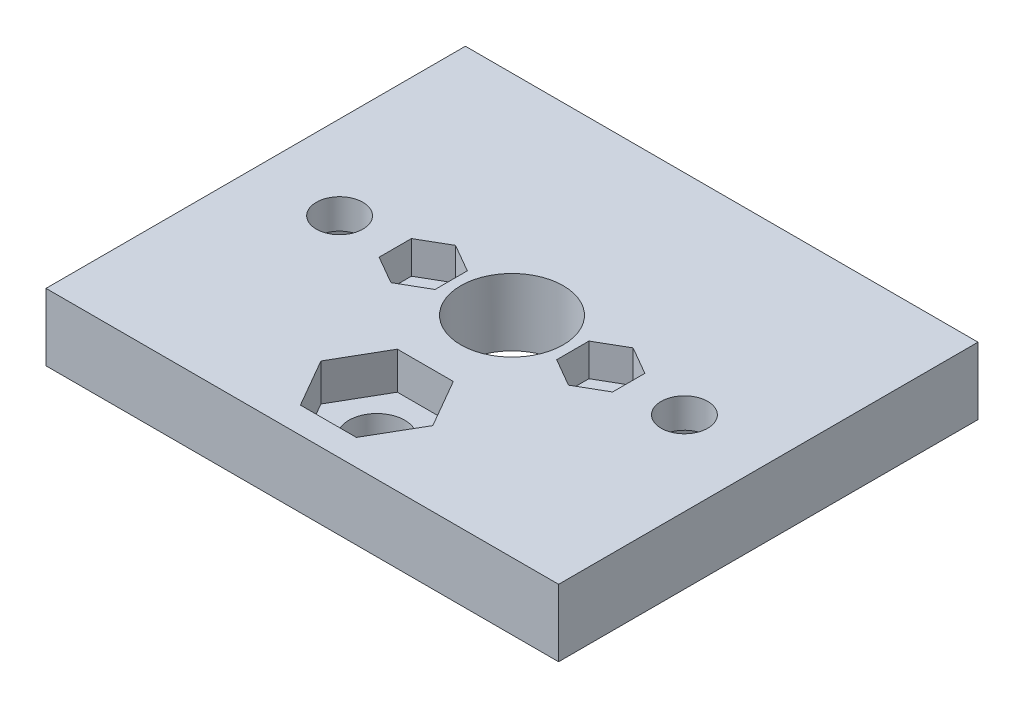
from build123d import *

# Parameters (mm, degrees)
SKETCH1_W               = 55
SKETCH1_H               = 45
BOSS_EXTRUDE1_DEPTH     = 7.2
CUT_EXTRUDE1_DEPTH      = 37.253827384
CUT_EXTRUDE1_DEPTH_BACK = 37.253827384
SKETCH2_R               = 5.5
SKETCH2_R_2             = 2.5
SKETCH2_R_3             = 1.5
CUT_EXTRUDE2_DEPTH      = 3.5
CUT_EXTRUDE3_DEPTH      = 4
CUT_EXTRUDE4_DEPTH      = 37.253827384
CUT_EXTRUDE4_DEPTH_BACK = 37.253827384
SKETCH7_R               = 3
CUT_EXTRUDE5_DEPTH      = 4


with BuildPart() as part:
    # Sketch1 → Boss-Extrude1 (new body)
    with BuildSketch(Plane(origin=(0, 0, 0), x_dir=(1, 0, 0), z_dir=(0, 1, 0))):
        Rectangle(SKETCH1_W, SKETCH1_H)
    extrude(amount=BOSS_EXTRUDE1_DEPTH)

    # Sketch2 → Cut-Extrude1 (cut, two sides: drawn at the far end of the back side and taken through both)
    with BuildSketch(Plane(origin=(0, 7.2, 0), x_dir=(1, 0, 0), z_dir=(0, 1, 0)).offset(-CUT_EXTRUDE1_DEPTH_BACK)):
        with Locations(Location((0, 0, 0), (0, 0, 270))):
            Circle(SKETCH2_R)
        with Locations(Location((-18.5, 0, 0), (0, 0, 270))):
            Circle(SKETCH2_R_2)
        with Locations(Location((18.5, 0, 0), (0, 0, 270))):
            Circle(SKETCH2_R_2)
        with Locations(Location((-9.525, 0, 0), (0, 0, 270))):
            Circle(SKETCH2_R_3)
        with Locations(Location((9.525, 0, 0), (0, 0, 270))):
            Circle(SKETCH2_R_3)
    extrude(amount=CUT_EXTRUDE1_DEPTH + CUT_EXTRUDE1_DEPTH_BACK, mode=Mode.SUBTRACT)

    # Sketch3 → Cut-Extrude2 (cut)
    with BuildSketch(Plane(origin=(0, 7.2, 0), x_dir=(1, 0, 0), z_dir=(0, 1, 0))):
        Polygon((-9.525, 3.464101615), (-12.525, 1.732050808), (-12.525, -1.732050808), (-9.525, -3.464101615), (-6.525, -1.732050808), (-6.525, 1.732050808), align=None)
        Polygon((9.525, 3.464101615), (6.525, 1.732050808), (6.525, -1.732050808), (9.525, -3.464101615), (12.525, -1.732050808), (12.525, 1.732050808), align=None)
    extrude(amount=-CUT_EXTRUDE2_DEPTH, mode=Mode.SUBTRACT)

    # Sketch5 → Cut-Extrude3 (cut)
    with BuildSketch(Plane.XZ):
        Polygon((23.349742261, 0), (20.924871131, 4.2), (16.075128869, 4.2), (13.650257739, 0), (16.075128869, -4.2), (20.924871131, -4.2), align=None)
        Polygon((-13.650257739, 0), (-16.075128869, 4.2), (-20.924871131, 4.2), (-23.349742261, 0), (-20.924871131, -4.2), (-16.075128869, -4.2), align=None)
    extrude(amount=-CUT_EXTRUDE3_DEPTH, mode=Mode.SUBTRACT)

    # Sketch7 → Cut-Extrude4 (cut, two sides: drawn at the far end of the back side and taken through both)
    with BuildSketch(Plane(origin=(0, 7.2, 0), x_dir=(1, 0, 0), z_dir=(0, 1, 0)).offset(-CUT_EXTRUDE4_DEPTH_BACK)):
        with Locations(Location((0, -14.5, 0), (0, 0, 270))):
            Circle(SKETCH7_R)
    extrude(amount=CUT_EXTRUDE4_DEPTH + CUT_EXTRUDE4_DEPTH_BACK, mode=Mode.SUBTRACT)

    # Sketch8 → Cut-Extrude5 (cut)
    with BuildSketch(Plane(origin=(0, 7.2, 0), x_dir=(1, 0, 0), z_dir=(0, 1, 0))):
        Polygon((6.0044428, -14.5), (3.0022214, -9.3), (-3.0022214, -9.3), (-6.0044428, -14.5), (-3.0022214, -19.7), (3.0022214, -19.7), align=None)
    extrude(amount=-CUT_EXTRUDE5_DEPTH, mode=Mode.SUBTRACT)


solid = part.part
